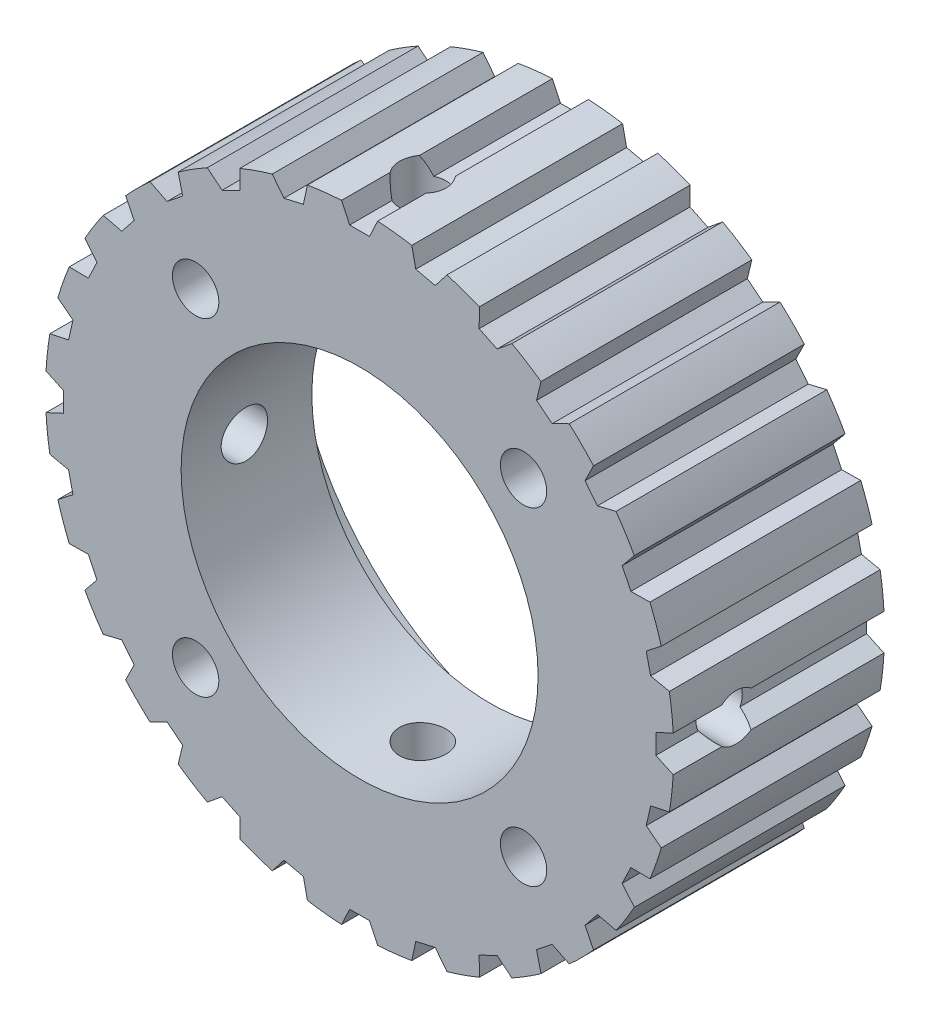
from build123d import *

# Parameters (mm, degrees)
SKETCH1_R               = 22.35
BOSS_EXTRUDE1_DEPTH     = 15
CUT_EXTRUDE1_DEPTH      = 35.986354483
SKETCH3_R               = 12.7
CUT_EXTRUDE2_DEPTH      = 35.939286654
SKETCH4_R               = 20
CUT_EXTRUDE3_DEPTH      = 5.7
SKETCH5_R               = 1.65
CUT_EXTRUDE4_DEPTH      = 33.897473336
CUT_EXTRUDE5_DEPTH      = 35.939286654
CUT_EXTRUDE5_DEPTH_BACK = 35.939286654
SKETCH6_R               = 1.65
CUT_EXTRUDE6_DEPTH      = 35.939286761
CUT_EXTRUDE6_DEPTH_BACK = 35.939286761
SKETCH7_R               = 1.65


with BuildPart() as part:
    # Sketch1 → Boss-Extrude1 (new body)
    with BuildSketch(Plane.XY):
        Circle(SKETCH1_R)
    extrude(amount=BOSS_EXTRUDE1_DEPTH)

    # Sketch2 → Cut-Extrude1 (cut, through all)
    with BuildSketch(Plane(origin=(0, 0, 0), x_dir=(-1, 0, 0), z_dir=(0, 0, -1))):
        Polygon((-0.707789274, 21.08), (0.707789274, 21.08), (1.3, 22.35), (-1.3, 22.35), align=None)
        Polygon((4.000697768, 20.708978319), (5.380784807, 20.393982458), (6.24074916, 21.500361623), (3.705936588, 22.078916051), align=None)
        Polygon((8.50857312, 19.299521992), (9.783965322, 18.685325479), (10.868561098, 19.572605337), (8.526042041, 20.700703058), align=None)
        Polygon((12.589793086, 16.922307045), (13.696536961, 16.039708256), (14.951377999, 16.663396891), (12.918616144, 18.284470376), align=None)
        Polygon((16.039708256, 13.696536961), (16.922307045, 12.589793086), (18.284470376, 12.918616144), (16.663396891, 14.951377999), align=None)
        Polygon((18.685325479, 9.783965322), (19.299521992, 8.50857312), (20.700703058, 8.526042041), (19.572605337, 10.868561098), align=None)
        Polygon((20.393982458, 5.380784807), (20.708978319, 4.000697768), (22.078916051, 3.705936588), (21.500361623, 6.24074916), align=None)
        Polygon((21.08, 0.707789274), (21.08, -0.707789274), (22.35, -1.3), (22.35, 1.3), align=None)
        Polygon((20.708978319, -4.000697768), (20.393982458, -5.380784807), (21.500361623, -6.24074916), (22.078916051, -3.705936588), align=None)
        Polygon((19.299521992, -8.50857312), (18.685325479, -9.783965322), (19.572605337, -10.868561098), (20.700703058, -8.526042041), align=None)
        Polygon((16.922307045, -12.589793086), (16.039708256, -13.696536961), (16.663396891, -14.951377999), (18.284470376, -12.918616144), align=None)
        Polygon((13.696536961, -16.039708256), (12.589793086, -16.922307045), (12.918616144, -18.284470376), (14.951377999, -16.663396891), align=None)
        Polygon((9.783965322, -18.685325479), (8.50857312, -19.299521992), (8.526042041, -20.700703058), (10.868561098, -19.572605337), align=None)
        Polygon((5.380784807, -20.393982458), (4.000697768, -20.708978319), (3.705936588, -22.078916051), (6.24074916, -21.500361623), align=None)
        Polygon((0.707789274, -21.08), (-0.707789274, -21.08), (-1.3, -22.35), (1.3, -22.35), align=None)
        Polygon((-4.000697768, -20.708978319), (-5.380784807, -20.393982458), (-6.24074916, -21.500361623), (-3.705936588, -22.078916051), align=None)
        Polygon((-8.50857312, -19.299521992), (-9.783965322, -18.685325479), (-10.868561098, -19.572605337), (-8.526042041, -20.700703058), align=None)
        Polygon((-12.589793086, -16.922307045), (-13.696536961, -16.039708256), (-14.951377999, -16.663396891), (-12.918616144, -18.284470376), align=None)
        Polygon((-16.039708256, -13.696536961), (-16.922307045, -12.589793086), (-18.284470376, -12.918616144), (-16.663396891, -14.951377999), align=None)
        Polygon((-18.685325479, -9.783965322), (-19.299521992, -8.50857312), (-20.700703058, -8.526042041), (-19.572605337, -10.868561098), align=None)
        Polygon((-20.393982458, -5.380784807), (-20.708978319, -4.000697768), (-22.078916051, -3.705936588), (-21.500361623, -6.24074916), align=None)
        Polygon((-21.08, -0.707789274), (-21.08, 0.707789274), (-22.35, 1.3), (-22.35, -1.3), align=None)
        Polygon((-20.708978319, 4.000697768), (-20.393982458, 5.380784807), (-21.500361623, 6.24074916), (-22.078916051, 3.705936588), align=None)
        Polygon((-19.299521992, 8.50857312), (-18.685325479, 9.783965322), (-19.572605337, 10.868561098), (-20.700703058, 8.526042041), align=None)
        Polygon((-16.922307045, 12.589793086), (-16.039708256, 13.696536961), (-16.663396891, 14.951377999), (-18.284470376, 12.918616144), align=None)
        Polygon((-13.696536961, 16.039708256), (-12.589793086, 16.922307045), (-12.918616144, 18.284470376), (-14.951377999, 16.663396891), align=None)
        Polygon((-9.783965322, 18.685325479), (-8.50857312, 19.299521992), (-8.526042041, 20.700703058), (-10.868561098, 19.572605337), align=None)
        Polygon((-5.380784807, 20.393982458), (-4.000697768, 20.708978319), (-3.705936588, 22.078916051), (-6.24074916, 21.500361623), align=None)
    extrude(amount=-CUT_EXTRUDE1_DEPTH, mode=Mode.SUBTRACT)

    # Sketch3 → Cut-Extrude2 (cut, through all)
    with BuildSketch(Plane(origin=(0, 0, 0), x_dir=(-1, 0, 0), z_dir=(0, 0, -1))):
        Circle(SKETCH3_R)
    extrude(amount=-CUT_EXTRUDE2_DEPTH, mode=Mode.SUBTRACT)

    # Sketch4 → Cut-Extrude3 (cut)
    with BuildSketch(Plane(origin=(0, 0, 0), x_dir=(-1, 0, 0), z_dir=(0, 0, -1))):
        Circle(SKETCH4_R)
    extrude(amount=-CUT_EXTRUDE3_DEPTH, mode=Mode.SUBTRACT)

    # Sketch5 → Cut-Extrude4 (cut, through all)
    with BuildSketch(Plane(origin=(0, 0, 5.7), x_dir=(-1, 0, 0), z_dir=(0, 0, -1))):
        with Locations((-11.66726189, 11.66726189)):
            Circle(SKETCH5_R)
        with Locations((11.66726189, 11.66726189)):
            Circle(SKETCH5_R)
        with Locations((11.66726189, -11.66726189)):
            Circle(SKETCH5_R)
        with Locations((-11.66726189, -11.66726189)):
            Circle(SKETCH5_R)
    extrude(amount=-CUT_EXTRUDE4_DEPTH, mode=Mode.SUBTRACT)

    # Sketch6 → Cut-Extrude5 (cut, two sides: drawn at the far end of the back side and taken through both)
    with BuildSketch(Plane(origin=(0, 0, 0), x_dir=(1, 0, 0), z_dir=(0, 1, 0)).offset(-CUT_EXTRUDE5_DEPTH_BACK)):
        with Locations(Location((0, -10.5, 0), (0, 0, 270))):
            Circle(SKETCH6_R)
    extrude(amount=CUT_EXTRUDE5_DEPTH + CUT_EXTRUDE5_DEPTH_BACK, mode=Mode.SUBTRACT)

    # Sketch7 → Cut-Extrude6 (cut, two sides: drawn at the far end of the back side and taken through both)
    with BuildSketch(Plane(origin=(0, 0, 0), x_dir=(0, 0, -1), z_dir=(1, 0, 0)).offset(-CUT_EXTRUDE6_DEPTH_BACK)):
        with Locations((-10.5, 0)):
            Circle(SKETCH7_R)
    extrude(amount=CUT_EXTRUDE6_DEPTH + CUT_EXTRUDE6_DEPTH_BACK, mode=Mode.SUBTRACT)


solid = part.part
